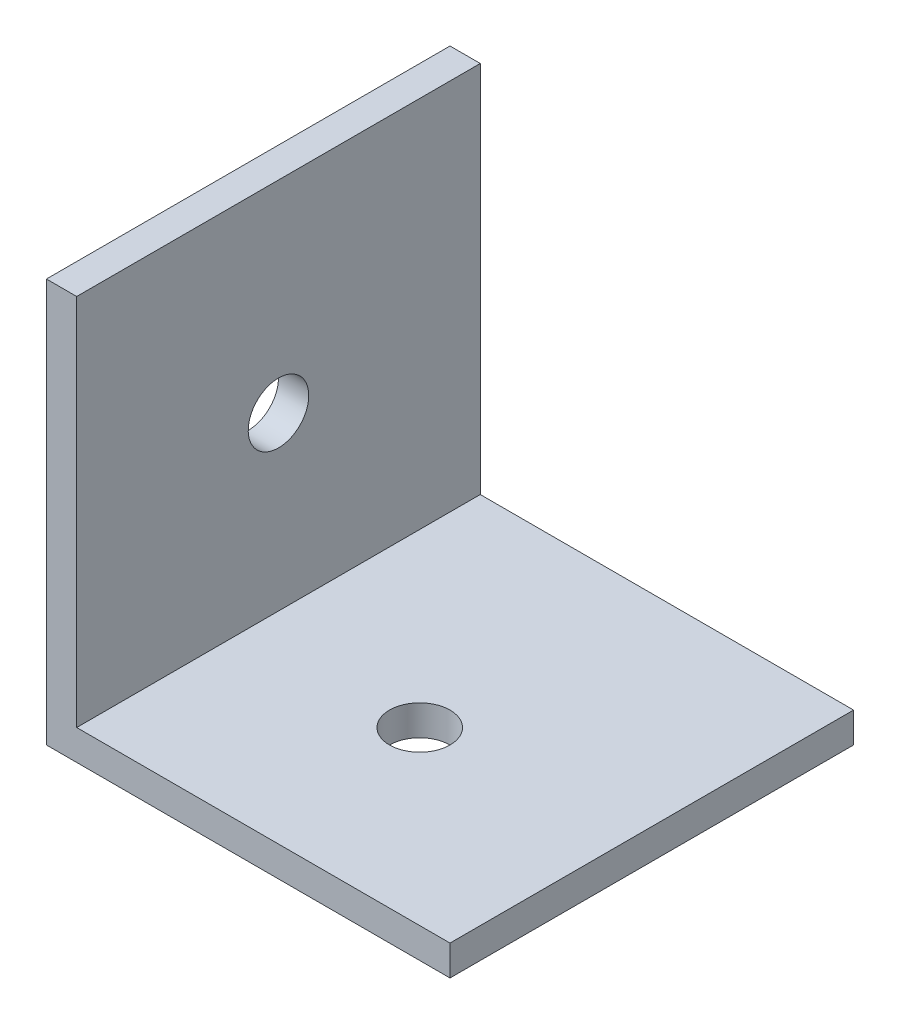
from build123d import *

# Parameters (mm, degrees)
EXTRUSION1_DEPTH = 20
ESQUISSE7_R      = 1.5
EXTRUSION7_DEPTH = 34.797189232
ESQUISSE9_R      = 1.5
EXTRUSION8_DEPTH = 34.797189232


with BuildPart() as part:
    # Esquisse1 → Extrusion1 (new body)
    with BuildSketch(Plane.XY):
        Polygon((0, 0), (20, 0), (20, 1.5), (1.5, 1.5), (1.5, 20), (0, 20), align=None)
    extrude(amount=EXTRUSION1_DEPTH)

    # Esquisse7 → Extrusion7 (cut, through all)
    with BuildSketch(Plane(origin=(0, 1.5, 0), x_dir=(-1, 0, 0), z_dir=(0, 1, 0))):
        with Locations((-10, 11.5)):
            Circle(ESQUISSE7_R)
    extrude(amount=-EXTRUSION7_DEPTH, mode=Mode.SUBTRACT)

    # Esquisse9 → Extrusion8 (cut, through all)
    with BuildSketch(Plane(origin=(1.5, 0, 0), x_dir=(0, 0, -1), z_dir=(1, 0, 0))):
        with Locations(Location((-10, 10, 0), (0, 0, 90))):
            Circle(ESQUISSE9_R)
    extrude(amount=-EXTRUSION8_DEPTH, mode=Mode.SUBTRACT)


solid = part.part
